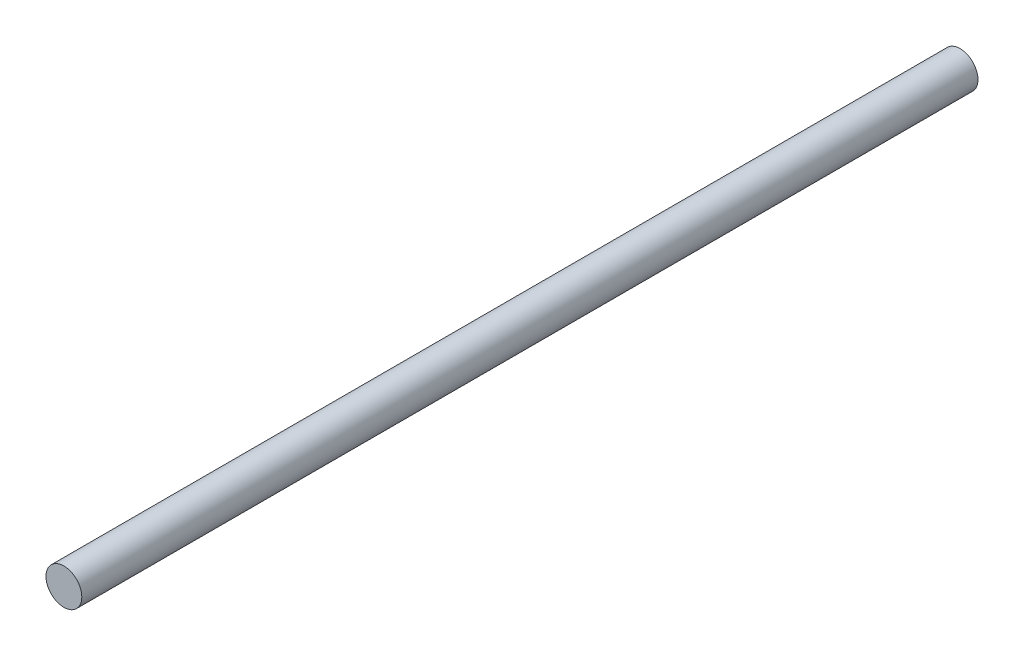
from build123d import *

# Parameters (mm, degrees)
SKETCH_1_R      = 8
EXTRUDE_1_DEPTH = 400


with BuildPart() as part:
    # 草图1 → 凸台-拉伸1 (new body)
    with BuildSketch(Plane.XY):
        Circle(SKETCH_1_R)
    extrude(amount=EXTRUDE_1_DEPTH)


solid = part.part
